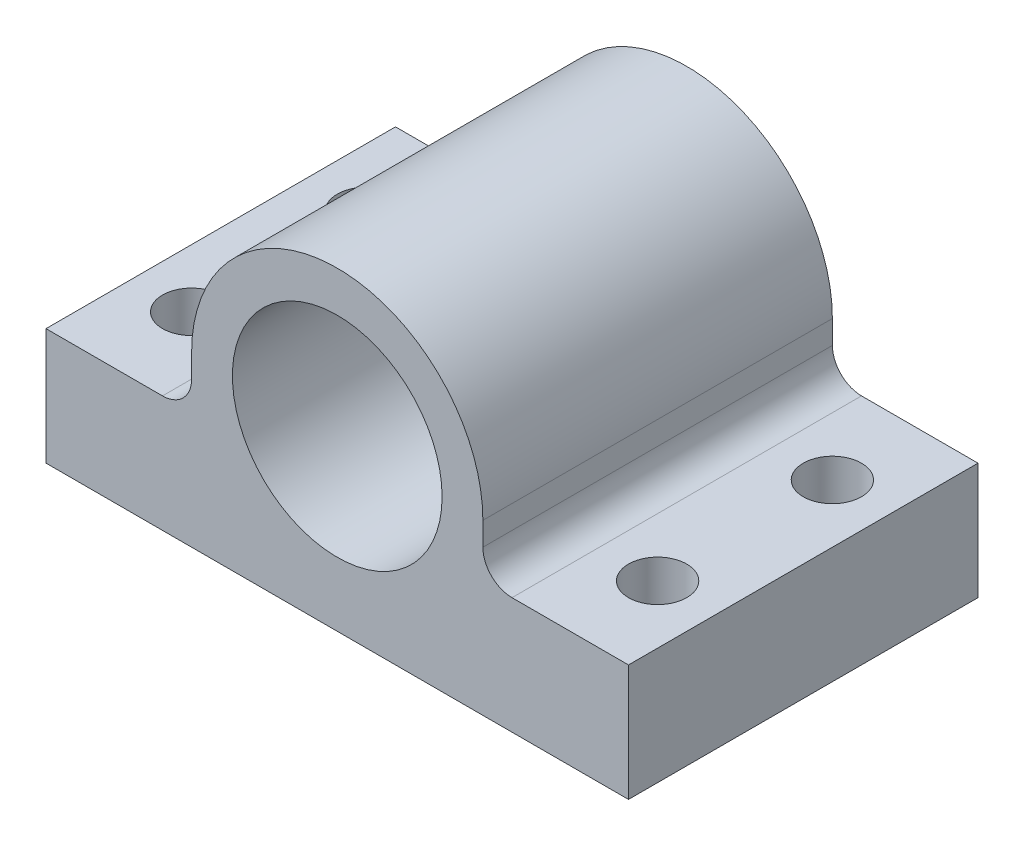
from build123d import *

# Parameters (mm, degrees)
SKETCH1_R           = 9
BOSS_EXTRUDE1_DEPTH = 30
SKETCH3_R           = 2.5
CUT_EXTRUDE1_DEPTH  = 17.65


with BuildPart() as part:
    # Sketch1 → Boss-Extrude1 (new body)
    with BuildSketch(Plane.XY):
        with BuildLine():
            Line((0, 0), (-25, 0))
            Line((-25, 0), (-25, 10))
            Line((-25, 10), (-15, 10))
            ThreePointArc((-15, 10), (-13.232233047, 10.732233047), (-12.5, 12.5))
            Line((-12.5, 12.5), (-12.5, 14.5))
            ThreePointArc((-12.5, 14.5), (0, 27), (12.5, 14.5))
            Line((12.5, 14.5), (12.5, 12.5))
            ThreePointArc((12.5, 12.5), (13.232233047, 10.732233047), (15, 10))
            Line((15, 10), (25, 10))
            Line((25, 10), (25, 0))
            Line((25, 0), (0, 0))
        make_face()
        with Locations((0, 14.5)):
            Circle(SKETCH1_R, mode=Mode.SUBTRACT)
    extrude(amount=BOSS_EXTRUDE1_DEPTH)

    # Sketch3 → Cut-Extrude1 (cut)
    with BuildSketch(Plane(origin=(0, 10, 0), x_dir=(1, 0, 0), z_dir=(0, 1, 0))):
        with Locations(Location((-20, -7.5, 0), (0, 0, 270))):
            Circle(SKETCH3_R)
        with Locations(Location((-20, -22.5, 0), (0, 0, 180))):
            Circle(SKETCH3_R)
        with Locations(Location((20, -22.5, 0), (0, 0, 270))):
            Circle(SKETCH3_R)
        with Locations(Location((20, -7.5, 0), (0, 0, 180))):
            Circle(SKETCH3_R)
    extrude(amount=-CUT_EXTRUDE1_DEPTH, mode=Mode.SUBTRACT)


solid = part.part
